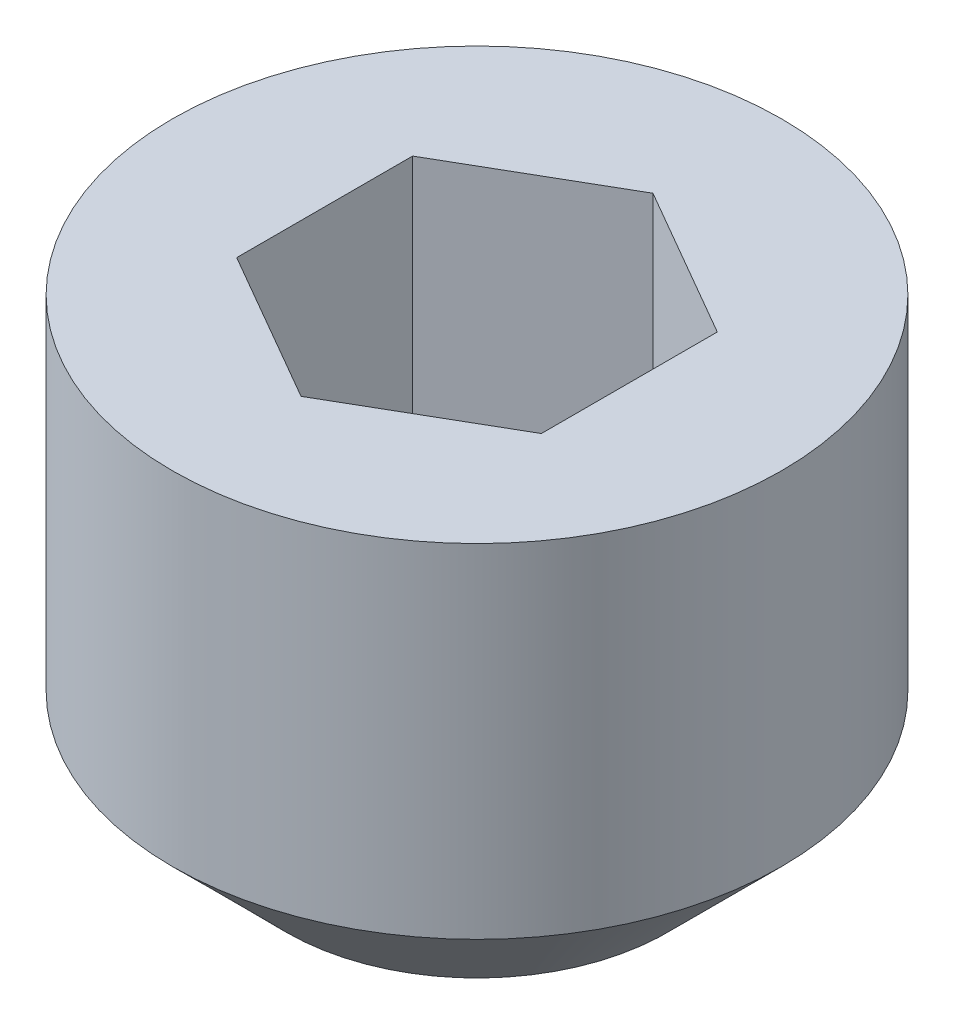
from build123d import *

# Parameters (mm, degrees)
SKETCH1_W          = 2
SKETCH1_H          = 3
CUT_EXTRUDE1_DEPTH = 1.5


with BuildPart() as part:
    # Sketch1 → Revolve1 (revolve)
    with BuildSketch(Plane.XY, mode=Mode.PRIVATE) as revolve1_sk:
        with Locations((1, 1.5)):
            Rectangle(SKETCH1_W, SKETCH1_H)
    revolve(revolve1_sk.sketch.rotate(Axis((0, 3, 0), (0, -1, 0)), 180), axis=Axis((0, 3, 0), (0, -1, 0)))

    # Sketch2 → Cut-Revolve1 (revolve, cut)
    with BuildSketch(Plane.XY, mode=Mode.PRIVATE) as cut_revolve1_sk:
        Polygon((0, 3), (1, 3), (1, 1.5), (0, 0.922649731), align=None)
    revolve(cut_revolve1_sk.sketch.rotate(Axis((0, 3, 0), (0, -1, 0)), 180), axis=Axis((0, 3, 0), (0, -1, 0)), mode=Mode.SUBTRACT)

    # Sketch3 → Cut-Extrude1 (cut)
    with BuildSketch(Plane(origin=(0, 3, 0), x_dir=(1, 0, 0), z_dir=(0, 1, 0))):
        Polygon((0, 1.154700538), (-1, 0.577350269), (-1, -0.577350269), (0, -1.154700538), (1, -0.577350269), (1, 0.577350269), align=None)
    extrude(amount=-CUT_EXTRUDE1_DEPTH, mode=Mode.SUBTRACT)

    # Sketch4 → Cut-Revolve2 (revolve, cut)
    with BuildSketch(Plane.XY, mode=Mode.PRIVATE) as cut_revolve2_sk:
        Polygon((1.25, 0), (2, 0), (2, 0.75), align=None)
    revolve(cut_revolve2_sk.sketch.rotate(Axis((0, 0, 0), (0, 1, 0)), 180), axis=Axis((0, 0, 0), (0, 1, 0)), mode=Mode.SUBTRACT)


solid = part.part
